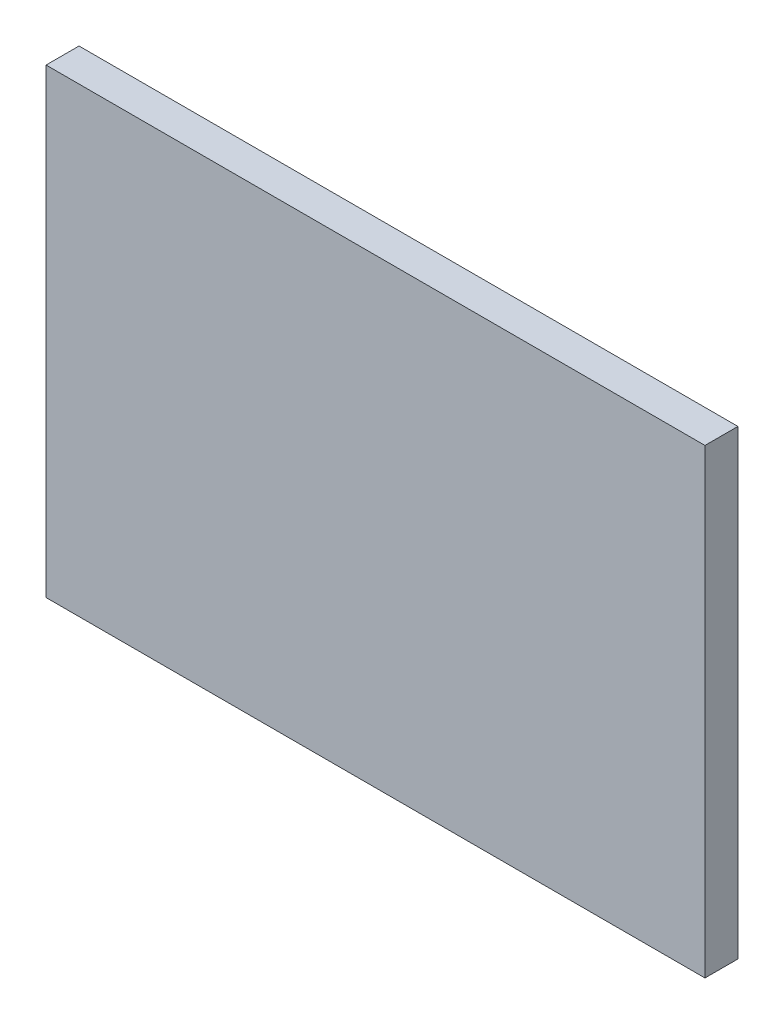
from build123d import *

# Parameters (mm, degrees)
SKETCH_1_W      = 200
SKETCH_1_H      = 10
EXTRUDE_1_DEPTH = 140


with BuildPart() as part:
    # Эскиз1 → Бобышка-Вытянуть1 (new body)
    with BuildSketch(Plane(origin=(0, 0, 0), x_dir=(1, 0, 0), z_dir=(0, 1, 0))):
        with Locations((100, 5)):
            Rectangle(SKETCH_1_W, SKETCH_1_H)
    extrude(amount=-EXTRUDE_1_DEPTH)


solid = part.part
